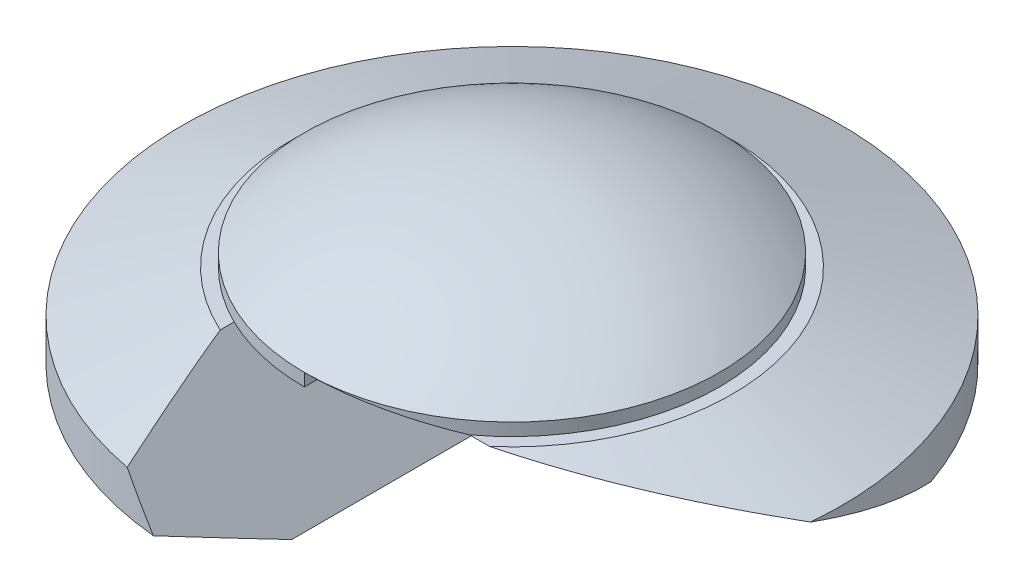
from build123d import *

# Parameters (mm, degrees)
CROQUIS1_R              = 52.5
SALIENTE_EXTRUIR1_DEPTH = 10
SALIENTE_EXTRUIR1_DRAFT = -69
CROQUIS2_R              = 78.550890647
SALIENTE_EXTRUIR2_DEPTH = 10
CROQUIS3_R              = 78.550890647
SALIENTE_EXTRUIR3_DEPTH = 10
SALIENTE_EXTRUIR3_TAPER = 69
CROQUIS4_R              = 49.5
SALIENTE_EXTRUIR4_DEPTH = 3
C_PULA1_FACE_RADIUS     = 49.5
C_PULA1_HEIGHT          = 16
CORTAR_EXTRUIR1_DEPTH   = 122.414516736
CORTAR_EXTRUIR3_REACH   = 184.352


with BuildPart() as part:
    # Croquis1 → Saliente-Extruir1 (with draft: the straight prism first)
    with BuildSketch(Plane(origin=(0, 0, 0), x_dir=(1, 0, 0), z_dir=(0, 1, 0))):
        Circle(CROQUIS1_R)
    extrude(amount=SALIENTE_EXTRUIR1_DEPTH)
    # Saliente-Extruir1: the draft: its side faces are tilted about the plane it starts from
    saliente_extruir1_sides = [part.faces().sort_by_distance(p)[0] for p in [
        (-52.5, 5, 0),
    ]]
    draft(saliente_extruir1_sides, Plane(origin=(0, 0, 0), x_dir=(1, 0, 0), z_dir=(0, 1, 0)), SALIENTE_EXTRUIR1_DRAFT)

    # Croquis2 → Saliente-Extruir2 (add)
    with BuildSketch(Plane(origin=(0, 10, 0), x_dir=(1, 0, 0), z_dir=(0, 1, 0))):
        with Locations(Location((0, 0, 0), (0, 0, 270))):
            Circle(CROQUIS2_R)
    extrude(amount=SALIENTE_EXTRUIR2_DEPTH)

    # Croquis3 → Saliente-Extruir3 (add)
    with BuildSketch(Plane(origin=(0, 20, 0), x_dir=(1, 0, 0), z_dir=(0, 1, 0))):
        with Locations(Location((0, 0, 0), (0, 0, 270))):
            Circle(CROQUIS3_R)
    extrude(amount=SALIENTE_EXTRUIR3_DEPTH, taper=SALIENTE_EXTRUIR3_TAPER)

    # Croquis4 → Saliente-Extruir4 (add)
    with BuildSketch(Plane(origin=(0, 30, 0), x_dir=(1, 0, 0), z_dir=(0, 1, 0))):
        with Locations(Location((0, 0, 0), (0, 0, 270))):
            Circle(CROQUIS4_R)
    extrude(amount=SALIENTE_EXTRUIR4_DEPTH)

    # Cúpula1: a dome of height H over a round flat face of radius A is a cap of a sphere of radius (A * A + H * H) / (2 * H)
    c_pula1_r = (C_PULA1_FACE_RADIUS * C_PULA1_FACE_RADIUS + C_PULA1_HEIGHT * C_PULA1_HEIGHT) / (2 * C_PULA1_HEIGHT)
    c_pula1_base = Plane((0, 33, 0), z_dir=(0, 1, 0))
    with Locations(c_pula1_base.offset(C_PULA1_HEIGHT - c_pula1_r)):
        c_pula1_ball = Sphere(c_pula1_r, mode=Mode.PRIVATE)
    add(split(c_pula1_ball, bisect_by=c_pula1_base, keep=Keep.TOP, mode=Mode.PRIVATE))

    # Croquis6 → Cortar-Extruir1 (cut, through all)
    with BuildSketch(Plane(origin=(0, 0, 0), x_dir=(0, 0, -1), z_dir=(1, 0, 0))):
        Polygon((-49.5, 33), (55.064393683, 0.984378507), (52.5, 0), (-52.5, 0), (-78.550890647, 10), (-78.550890647, 20), align=None)
    extrude(amount=CORTAR_EXTRUIR1_DEPTH, mode=Mode.SUBTRACT)

    # Cortar-Extruir3: up to this plane
    cortar_extruir3_end = Plane(origin=(78.550890647, 33, 49.5), z_dir=(0, -0.9561843075173418, 0.2927653839810668))
    # Croquis9 → Cortar-Extruir3 (cut, up to the surface)
    with BuildSketch(Plane.XY.offset(78.550890647), mode=Mode.PRIVATE) as cortar_extruir3_sk1:
        Polygon((0, 0), (-21.79627584, 30), (0, 30), align=None)
    cortar_extruir3_tool1 = split(extrude(cortar_extruir3_sk1.sketch, amount=-CORTAR_EXTRUIR3_REACH, mode=Mode.PRIVATE), bisect_by=cortar_extruir3_end, keep=Keep.BOTH, mode=Mode.PRIVATE)
    add(cortar_extruir3_tool1.solids().sort_by_distance((-7.265425, 20, 78.550891))[0], mode=Mode.SUBTRACT)


solid = part.part
